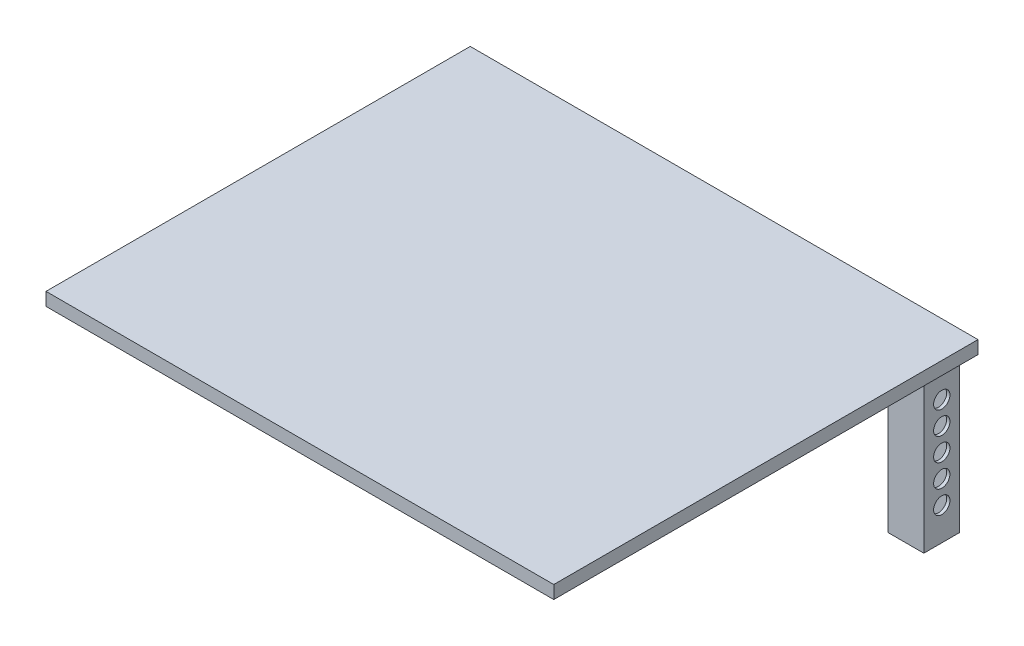
from build123d import *

# Parameters (mm, degrees)
SKETCH1_W           = 27.94
SKETCH1_H           = 27.94
BOSS_EXTRUDE1_DEPTH = 127
CUT_EXTRUDE1_REACH  = 130.528
SKETCH2_W           = 22.86
SKETCH2_H           = 22.86
SKETCH3_W           = 381
SKETCH3_H           = 330.2
BOSS_EXTRUDE2_DEPTH = 10.16
CUT_EXTRUDE2_REACH  = 515.785
SKETCH4_R           = 6.35
SKETCH5_W           = 330.2
SKETCH5_H           = 10.16
BOSS_EXTRUDE3_DEPTH = 203.2
SKETCH7_R           = 7.5
CUT_EXTRUDE4_DEPTH  = 5.08
SKETCH8_W           = 330.2
SKETCH8_H           = 10.16
CUT_EXTRUDE5_DEPTH  = 188.976


with BuildPart() as part:
    # Sketch1 → Boss-Extrude1 (new body)
    with BuildSketch(Plane(origin=(0, 0, 0), x_dir=(1, 0, 0), z_dir=(0, 1, 0))):
        Rectangle(SKETCH1_W, SKETCH1_H)
    extrude(amount=BOSS_EXTRUDE1_DEPTH)

    # Sketch2 → Cut-Extrude1 (cut, up to next)
    with BuildSketch(Plane(origin=(0, 127, 0), x_dir=(1, 0, 0), z_dir=(0, 1, 0)), mode=Mode.PRIVATE) as cut_extrude1_sk1:
        Rectangle(SKETCH2_W, SKETCH2_H)
    cut_extrude1_tool1 = extrude(cut_extrude1_sk1.sketch, amount=-CUT_EXTRUDE1_REACH, mode=Mode.PRIVATE) & part.part
    add(cut_extrude1_tool1.solids().sort_by_distance((0, 127, 0))[0], mode=Mode.SUBTRACT)

    # Sketch3 → Boss-Extrude2 (add)
    with BuildSketch(Plane(origin=(0, 127, 0), x_dir=(1, 0, 0), z_dir=(0, 1, 0))):
        with Locations((-176.53, -151.13)):
            Rectangle(SKETCH3_W, SKETCH3_H)
    extrude(amount=BOSS_EXTRUDE2_DEPTH)

    # Sketch4 → Cut-Extrude2 (cut, up to next)
    with BuildSketch(Plane(origin=(13.97, 0, 0), x_dir=(0, 0, -1), z_dir=(1, 0, 0)), mode=Mode.PRIVATE) as cut_extrude2_sk1:
        with Locations((0, 25.4)):
            Circle(SKETCH4_R)
    cut_extrude2_tool1 = extrude(cut_extrude2_sk1.sketch, amount=-CUT_EXTRUDE2_REACH, mode=Mode.PRIVATE) & part.part
    # Sketch4 → Cut-Extrude2 (cut, up to next)
    with BuildSketch(Plane(origin=(13.97, 0, 0), x_dir=(0, 0, -1), z_dir=(1, 0, 0)), mode=Mode.PRIVATE) as cut_extrude2_sk2:
        with Locations((0, 43.18)):
            Circle(SKETCH4_R)
    cut_extrude2_tool2 = extrude(cut_extrude2_sk2.sketch, amount=-CUT_EXTRUDE2_REACH, mode=Mode.PRIVATE) & part.part
    # Sketch4 → Cut-Extrude2 (cut, up to next)
    with BuildSketch(Plane(origin=(13.97, 0, 0), x_dir=(0, 0, -1), z_dir=(1, 0, 0)), mode=Mode.PRIVATE) as cut_extrude2_sk3:
        with Locations((0, 60.96)):
            Circle(SKETCH4_R)
    cut_extrude2_tool3 = extrude(cut_extrude2_sk3.sketch, amount=-CUT_EXTRUDE2_REACH, mode=Mode.PRIVATE) & part.part
    # Sketch4 → Cut-Extrude2 (cut, up to next)
    with BuildSketch(Plane(origin=(13.97, 0, 0), x_dir=(0, 0, -1), z_dir=(1, 0, 0)), mode=Mode.PRIVATE) as cut_extrude2_sk4:
        with Locations((0, 78.74)):
            Circle(SKETCH4_R)
    cut_extrude2_tool4 = extrude(cut_extrude2_sk4.sketch, amount=-CUT_EXTRUDE2_REACH, mode=Mode.PRIVATE) & part.part
    # Sketch4 → Cut-Extrude2 (cut, up to next)
    with BuildSketch(Plane(origin=(13.97, 0, 0), x_dir=(0, 0, -1), z_dir=(1, 0, 0)), mode=Mode.PRIVATE) as cut_extrude2_sk5:
        with Locations((0, 96.52)):
            Circle(SKETCH4_R)
    cut_extrude2_tool5 = extrude(cut_extrude2_sk5.sketch, amount=-CUT_EXTRUDE2_REACH, mode=Mode.PRIVATE) & part.part
    add(cut_extrude2_tool1.solids().sort_by_distance((13.97, 25.4, 0))[0], mode=Mode.SUBTRACT)
    add(cut_extrude2_tool2.solids().sort_by_distance((13.97, 43.18, 0))[0], mode=Mode.SUBTRACT)
    add(cut_extrude2_tool3.solids().sort_by_distance((13.97, 60.96, 0))[0], mode=Mode.SUBTRACT)
    add(cut_extrude2_tool4.solids().sort_by_distance((13.97, 78.74, 0))[0], mode=Mode.SUBTRACT)
    add(cut_extrude2_tool5.solids().sort_by_distance((13.97, 96.52, 0))[0], mode=Mode.SUBTRACT)

    # Sketch5 → Boss-Extrude3 (add)
    with BuildSketch(Plane(origin=(13.97, 0, 0), x_dir=(0, 0, -1), z_dir=(1, 0, 0))):
        with Locations((-151.13, 132.08)):
            Rectangle(SKETCH5_W, SKETCH5_H)
    extrude(amount=BOSS_EXTRUDE3_DEPTH)

    # Sketch7 → Cut-Extrude4 (cut)
    with BuildSketch(Plane.XZ.offset(-127)):
        with Locations(Location((90.17, 43.501665218, 0), (0, 0, 270))):
            Circle(SKETCH7_R)
    extrude(amount=-CUT_EXTRUDE4_DEPTH, mode=Mode.SUBTRACT)

    # Sketch8 → Cut-Extrude5 (cut)
    with BuildSketch(Plane(origin=(217.17, 0, 0), x_dir=(0, 0, -1), z_dir=(1, 0, 0))):
        with Locations((-151.13, 132.08)):
            Rectangle(SKETCH8_W, SKETCH8_H)
    extrude(amount=-CUT_EXTRUDE5_DEPTH, mode=Mode.SUBTRACT)


solid = part.part
